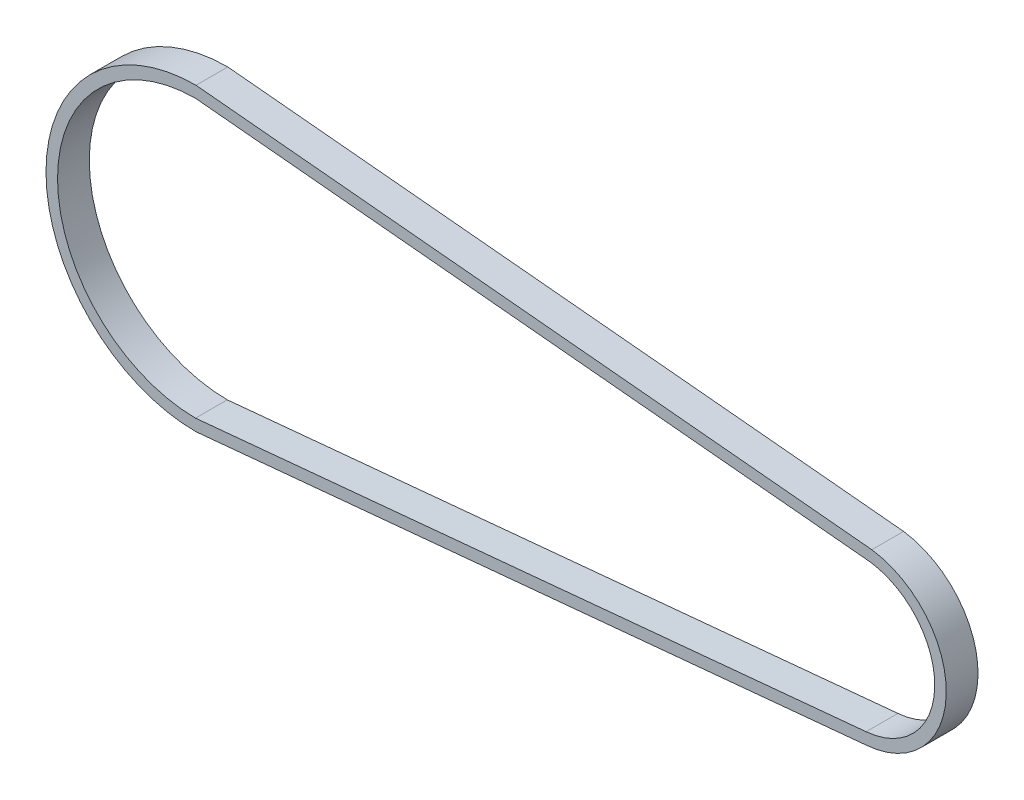
from build123d import *

# Parameters (mm, degrees)
BOSS_EXTRU_1_DEPTH = 5.5


with BuildPart() as part:
    # Esquisse1 → Boss.-Extru.1 (new body)
    with BuildSketch(Plane.XY):
        with BuildLine():
            Line((0, -26), (116.296767588, -14.943841334))
            ThreePointArc((116.296767588, -14.943841334), (129.994567149, -0.403678095), (117.098931421, 14.852423603))
            Line((117.098931421, 14.852423603), (0, 26))
            ThreePointArc((0, 26), (-26, 0), (0, -26))
        make_face()
        with BuildLine():
            Line((-0.092960895, -23.999819963), (116.115964374, -12.952012335))
            ThreePointArc((116.115964374, -12.952012335), (127.994568865, -0.375739288), (116.86249166, 12.865889974))
            Line((116.86249166, 12.865889974), (-0.093086907, 23.999819475))
            ThreePointArc((-0.093086907, 23.999819475), (-24, -6.3006e-05), (-0.092960895, -23.999819963))
        make_face(mode=Mode.SUBTRACT)
    extrude(amount=BOSS_EXTRU_1_DEPTH)


solid = part.part
